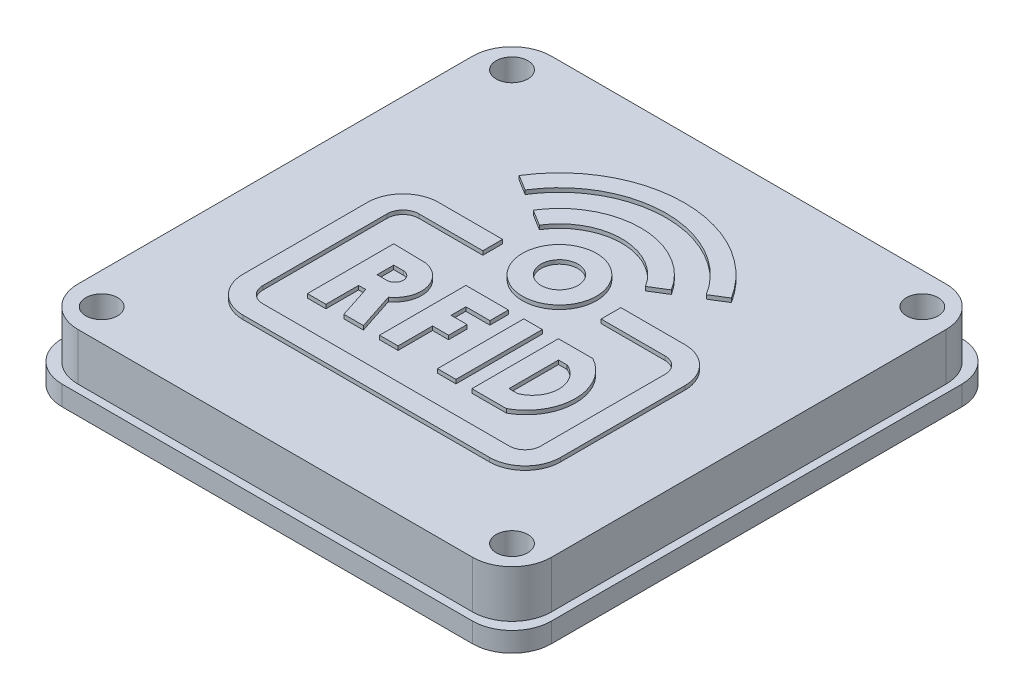
from build123d import *

# Parameters (mm, degrees)
SKETCH1_W           = 120
SKETCH1_H           = 120
BOSS_EXTRUDE1_DEPTH = 17
SHELL1_T            = -3
SKETCH2_W           = 124
SKETCH2_H           = 124
SKETCH2_W_2         = 120
SKETCH2_H_2         = 120
BOSS_EXTRUDE2_DEPTH = 5
SKETCH4_R           = 4.02
BOSS_EXTRUDE3_DEPTH = 14
SKETCH3_R           = 4.02
CUT_EXTRUDE1_DEPTH  = 3
FILLET1_R           = 10
SKETCH9_R           = 9.39878502
SKETCH9_R_2         = 4.690586007
SKETCH9_W           = 4.6868
SKETCH9_H           = 21.8714
BOSS_EXTRUDE7_DEPTH = 1


with BuildPart() as part:
    # Sketch1 → Boss-Extrude1 (new body)
    with BuildSketch(Plane(origin=(0, 0, 0), x_dir=(1, 0, 0), z_dir=(0, 1, 0))):
        Rectangle(SKETCH1_W, SKETCH1_H)
    extrude(amount=BOSS_EXTRUDE1_DEPTH)

    # Shell1
    shell1_openings = [part.faces().sort_by_distance(p)[0] for p in [
        (0, 0, 0),
    ]]
    offset(amount=SHELL1_T, openings=shell1_openings, kind=Kind.INTERSECTION)

    # Sketch2 → Boss-Extrude2 (add)
    with BuildSketch(Plane.XZ):
        Rectangle(SKETCH2_W, SKETCH2_H)
        Rectangle(SKETCH2_W_2, SKETCH2_H_2, mode=Mode.SUBTRACT)
    extrude(amount=-BOSS_EXTRUDE2_DEPTH)

    # Sketch4 → Boss-Extrude3 (add)
    # profile 1 of 4: a face of its own
    with BuildSketch(Plane.XZ.offset(-14)):
        with BuildLine():
            Line((-57, 42.98), (-57, 57))
            Line((-57, 57), (-42.98, 57))
            ThreePointArc((-42.98, 57), (-44.394213562, 56.414213562), (-44.98, 55))
            Line((-44.98, 55), (-44.98, 52))
            ThreePointArc((-44.98, 52), (-47.036110396, 47.036110396), (-52, 44.98))
            Line((-52, 44.98), (-55, 44.98))
            ThreePointArc((-55, 44.98), (-56.414213562, 44.394213562), (-57, 42.98))
        make_face()
        with Locations(Location((-52, 52, 0), (0, 0, 270))):
            Circle(SKETCH4_R, mode=Mode.SUBTRACT)
    # profile 2 of 4: a face of its own
    with BuildSketch(Plane.XZ.offset(-14)):
        with BuildLine():
            Line((57, 42.98), (57, 57))
            Line((57, 57), (42.98, 57))
            ThreePointArc((42.98, 57), (44.394213562, 56.414213562), (44.98, 55))
            Line((44.98, 55), (44.98, 52))
            ThreePointArc((44.98, 52), (47.036110396, 47.036110396), (52, 44.98))
            Line((52, 44.98), (55, 44.98))
            ThreePointArc((55, 44.98), (56.414213562, 44.394213562), (57, 42.98))
        make_face()
        with Locations(Location((52, 52, 0), (0, 0, 90))):
            Circle(SKETCH4_R, mode=Mode.SUBTRACT)
    # profile 3 of 4: a face of its own
    with BuildSketch(Plane.XZ.offset(-14)):
        with BuildLine():
            Line((55, -44.98), (52, -44.98))
            ThreePointArc((52, -44.98), (47.036110396, -47.036110396), (44.98, -52))
            Line((44.98, -52), (44.98, -55))
            ThreePointArc((44.98, -55), (44.394213562, -56.414213562), (42.98, -57))
            Line((42.98, -57), (57, -57))
            Line((57, -57), (57, -42.98))
            ThreePointArc((57, -42.98), (56.414213562, -44.394213562), (55, -44.98))
        make_face()
        with Locations(Location((52, -52, 0), (0, 0, 270))):
            Circle(SKETCH4_R, mode=Mode.SUBTRACT)
    # profile 4 of 4: a face of its own
    with BuildSketch(Plane.XZ.offset(-14)):
        with BuildLine():
            Line((-57, -42.98), (-57, -57))
            Line((-57, -57), (-42.98, -57))
            ThreePointArc((-42.98, -57), (-44.394213562, -56.414213562), (-44.98, -55))
            Line((-44.98, -55), (-44.98, -52))
            ThreePointArc((-44.98, -52), (-47.036110396, -47.036110396), (-52, -44.98))
            Line((-52, -44.98), (-55, -44.98))
            ThreePointArc((-55, -44.98), (-56.414213562, -44.394213562), (-57, -42.98))
        make_face()
        with Locations(Location((-52, -52, 0), (0, 0, 90))):
            Circle(SKETCH4_R, mode=Mode.SUBTRACT)
    extrude(amount=BOSS_EXTRUDE3_DEPTH)

    # Sketch3 → Cut-Extrude1 (cut)
    with BuildSketch(Plane(origin=(0, 17, 0), x_dir=(1, 0, 0), z_dir=(0, 1, 0))):
        with Locations(Location((-52, 52, 0), (0, 0, 270))):
            Circle(SKETCH3_R)
        with Locations(Location((52, 52, 0), (0, 0, 90))):
            Circle(SKETCH3_R)
        with Locations(Location((52, -52, 0), (0, 0, 270))):
            Circle(SKETCH3_R)
        with Locations(Location((-52, -52, 0), (0, 0, 90))):
            Circle(SKETCH3_R)
    extrude(amount=-CUT_EXTRUDE1_DEPTH, mode=Mode.SUBTRACT)

    # Fillet1
    fillet1_edges = [part.edges().sort_by_distance(p)[0] for p in [
        (62, 2.5, -62),
        (-62, 2.5, -62),
        (-62, 2.5, 62),
        (62, 2.5, 62),
        (60, 11, 60),
        (-60, 11, 60),
        (-60, 11, -60),
        (60, 11, -60),
    ]]
    fillet(fillet1_edges, radius=FILLET1_R)

    # Sketch9 → Boss-Extrude7 (add)
    # profile 1 of 8: a face of its own
    with BuildSketch(Plane(origin=(0, 17, 0), x_dir=(1, 0, 0), z_dir=(0, 1, 0))):
        with Locations(Location((0, 12.032739488, 0), (0, 0, 270))):
            Circle(SKETCH9_R)
        with Locations(Location((0, 12.032739488, 0), (0, 0, 270))):
            Circle(SKETCH9_R_2, mode=Mode.SUBTRACT)
    # profile 2 of 8: a face of its own
    with BuildSketch(Plane(origin=(0, 17, 0), x_dir=(1, 0, 0), z_dir=(0, 1, 0))):
        with BuildLine():
            Line((-13.44305, 20.375947386), (-17.50480026, 22.896805886))
            ThreePointArc((-17.50480026, 22.896805886), (0.002640651, 32.634825883), (17.507584665, 22.892318209))
            Line((17.507584665, 22.892318209), (13.445188322, 20.372501014))
            ThreePointArc((13.445188322, 20.372501014), (0.002027924, 27.854392601), (-13.44305, 20.375947386))
        make_face()
    # profile 3 of 8: a face of its own
    with BuildSketch(Plane(origin=(0, 17, 0), x_dir=(1, 0, 0), z_dir=(0, 1, 0))):
        with BuildLine():
            Line((-40.2286, -27.927144715), (-40.2286, 3.597555285))
            ThreePointArc((-40.2286, 3.597555285), (-37.592561031, 9.961516315), (-31.2286, 12.597555285))
            Line((-31.2286, 12.597555285), (-14.988446655, 12.597555285))
            Line((-14.988446655, 12.597555285), (-14.988446655, 7.597555285))
            Line((-14.988446655, 7.597555285), (-31.2286, 7.597555285))
            ThreePointArc((-31.2286, 7.597555285), (-34.057027125, 6.42598241), (-35.2286, 3.597555285))
            Line((-35.2286, 3.597555285), (-35.2286, -27.927144715))
            ThreePointArc((-35.2286, -27.927144715), (-34.057027125, -30.75557184), (-31.2286, -31.927144715))
            Line((-31.2286, -31.927144715), (31.2286, -31.927144715))
            ThreePointArc((31.2286, -31.927144715), (34.057027125, -30.75557184), (35.2286, -27.927144715))
            Line((35.2286, -27.927144715), (35.2286, 3.597555285))
            ThreePointArc((35.2286, 3.597555285), (34.057027125, 6.42598241), (31.2286, 7.597555285))
            Line((31.2286, 7.597555285), (14.988446655, 7.597555285))
            Line((14.988446655, 7.597555285), (14.988446655, 12.597555285))
            Line((14.988446655, 12.597555285), (31.2286, 12.597555285))
            ThreePointArc((31.2286, 12.597555285), (37.592561031, 9.961516315), (40.2286, 3.597555285))
            Line((40.2286, 3.597555285), (40.2286, -27.927144715))
            ThreePointArc((40.2286, -27.927144715), (37.592561031, -34.291105746), (31.2286, -36.927144715))
            Line((31.2286, -36.927144715), (-31.2286, -36.927144715))
            ThreePointArc((-31.2286, -36.927144715), (-37.592561031, -34.291105746), (-40.2286, -27.927144715))
        make_face()
    # profile 4 of 8: a face of its own
    with BuildSketch(Plane(origin=(0, 17, 0), x_dir=(1, 0, 0), z_dir=(0, 1, 0))):
        with BuildLine():
            Line((-22.967626314, 26.287219035), (-26.8861, 28.719155285))
            ThreePointArc((-26.8861, 28.719155285), (0.004055848, 43.676045714), (26.890376645, 28.712262541))
            Line((26.890376645, 28.712262541), (22.971279665, 26.281330863))
            ThreePointArc((22.971279665, 26.281330863), (0.003464735, 39.064240253), (-22.967626314, 26.287219035))
        make_face()
    # profile 5 of 8: a face of its own
    with BuildSketch(Plane(origin=(0, 17, 0), x_dir=(1, 0, 0), z_dir=(0, 1, 0))):
        with BuildLine():
            Line((-27.8078, -24.037744715), (-27.8077, -2.166344715))
            Line((-27.8077, -2.166344715), (-19.6684, -2.322544715))
            ThreePointArc((-19.6684, -2.322544715), (-14.083780395, -7.46632893), (-16.7627, -14.570544715))
            Line((-16.7627, -14.570544715), (-13.694775607, -23.959644715))
            Line((-13.694775607, -23.959644715), (-18.653, -23.959644715))
            Line((-18.653, -23.959644715), (-21.3088, -15.757844715))
            Line((-21.3088, -15.757844715), (-23.121, -15.757844715))
            Line((-23.121, -15.757844715), (-23.121, -24.037744715))
            Line((-23.121, -24.037744715), (-27.8078, -24.037744715))
        make_face()
        with BuildLine():
            Line((-23.1211, -6.853044715), (-23.1211, -11.071144715))
            Line((-23.1211, -11.071144715), (-20.688080887, -11.071144715))
            ThreePointArc((-20.688080887, -11.071144715), (-18.579030887, -8.962094715), (-20.688080887, -6.853044715))
            Line((-20.688080887, -6.853044715), (-23.1211, -6.853044715))
        make_face(mode=Mode.SUBTRACT)
    # profile 6 of 8: a face of its own
    with BuildSketch(Plane(origin=(0, 17, 0), x_dir=(1, 0, 0), z_dir=(0, 1, 0))):
        Polygon((-9.5295, -2.166244715), (-9.5295, -24.037744715), (-4.8428, -24.037744715), (-4.8428, -15.289144715), (-0.781, -15.289144715), (-0.781, -10.602344715), (-4.8428, -10.602344715), (-4.8428, -6.853044715), (1.25, -6.853044715), (1.25, -2.166244715), align=None)
    # profile 7 of 8: a face of its own
    with BuildSketch(Plane(origin=(0, 17, 0), x_dir=(1, 0, 0), z_dir=(0, 1, 0))):
        with Locations((7.4989, -13.102044715)):
            Rectangle(SKETCH9_W, SKETCH9_H)
    # profile 8 of 8: a face of its own
    with BuildSketch(Plane(origin=(0, 17, 0), x_dir=(1, 0, 0), z_dir=(0, 1, 0))):
        with BuildLine():
            Line((13.904, -2.135144715), (13.904, -24.068944715))
            Line((13.904, -24.068944715), (22.62153415, -24.068944715))
            ThreePointArc((22.62153415, -24.068944715), (29.187351473, -13.102044715), (22.62153415, -2.135144715))
            Line((22.62153415, -2.135144715), (13.904, -2.135144715))
        make_face()
        with BuildLine():
            Line((18.5908, -6.806144715), (18.5908, -19.351044715))
            Line((18.5908, -19.351044715), (20.808626637, -19.351044715))
            ThreePointArc((20.808626637, -19.351044715), (25.011270759, -13.078594715), (20.808626637, -6.806144715))
            Line((20.808626637, -6.806144715), (18.5908, -6.806144715))
        make_face(mode=Mode.SUBTRACT)
    extrude(amount=BOSS_EXTRUDE7_DEPTH)


solid = part.part
